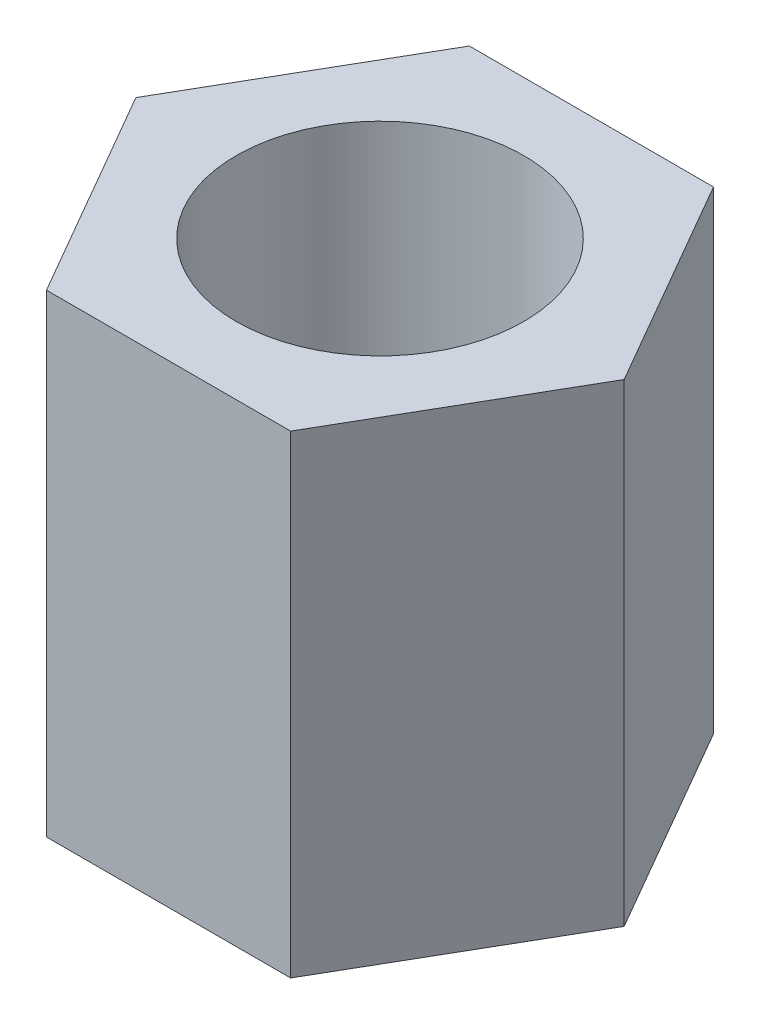
from build123d import *

# Parameters (mm, degrees)
SKETCH_1_R      = 1.7
EXTRUDE_1_DEPTH = 5.6


with BuildPart() as part:
    # 草图1 → 凸台-拉伸1 (new body)
    with BuildSketch(Plane(origin=(0, 0, 0), x_dir=(1, 0, 0), z_dir=(0, 1, 0))):
        Polygon((2.886751346, 0), (1.443375673, 2.5), (-1.443375673, 2.5), (-2.886751346, 0), (-1.443375673, -2.5), (1.443375673, -2.5), align=None)
        with Locations(Location((0, 0, 0), (0, 0, 270))):
            Circle(SKETCH_1_R, mode=Mode.SUBTRACT)
    extrude(amount=EXTRUDE_1_DEPTH)


solid = part.part
